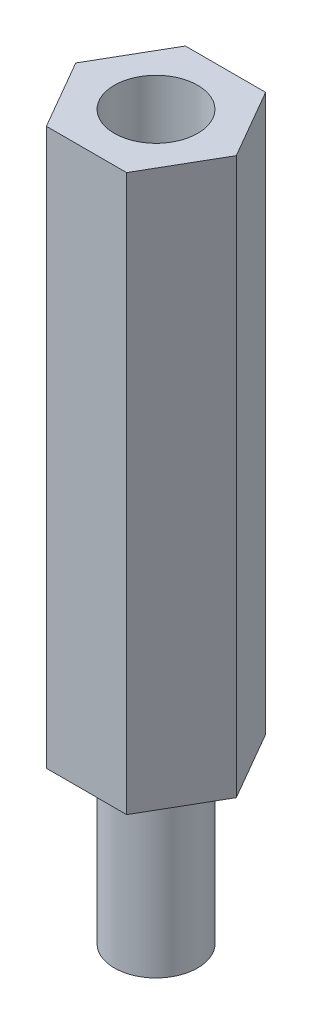
from build123d import *

# Parameters (mm, degrees)
CROQUIS1_R              = 1.5
SALIENTE_EXTRUIR1_DEPTH = 20
CROQUIS2_R              = 1.5
SALIENTE_EXTRUIR2_DEPTH = 6


with BuildPart() as part:
    # Croquis1 → Saliente-Extruir1 (new body)
    with BuildSketch(Plane(origin=(0, 0, 0), x_dir=(1, 0, 0), z_dir=(0, 1, 0))):
        Polygon((1.443375673, -2.5), (2.886751346, 0), (1.443375673, 2.5), (-1.443375673, 2.5), (-2.886751346, 0), (-1.443375673, -2.5), align=None)
        with Locations(Location((0, 0, 0), (0, 0, 270))):
            Circle(CROQUIS1_R, mode=Mode.SUBTRACT)
    extrude(amount=SALIENTE_EXTRUIR1_DEPTH)


with BuildPart() as body_2:
    # Croquis2 → Saliente-Extruir2 (new body)
    with BuildSketch(Plane.XZ):
        with Locations(Location((0, 0, 0), (0, 0, 270))):
            Circle(CROQUIS2_R)
    extrude(amount=SALIENTE_EXTRUIR2_DEPTH)


solid = Compound([part.part, body_2.part])
